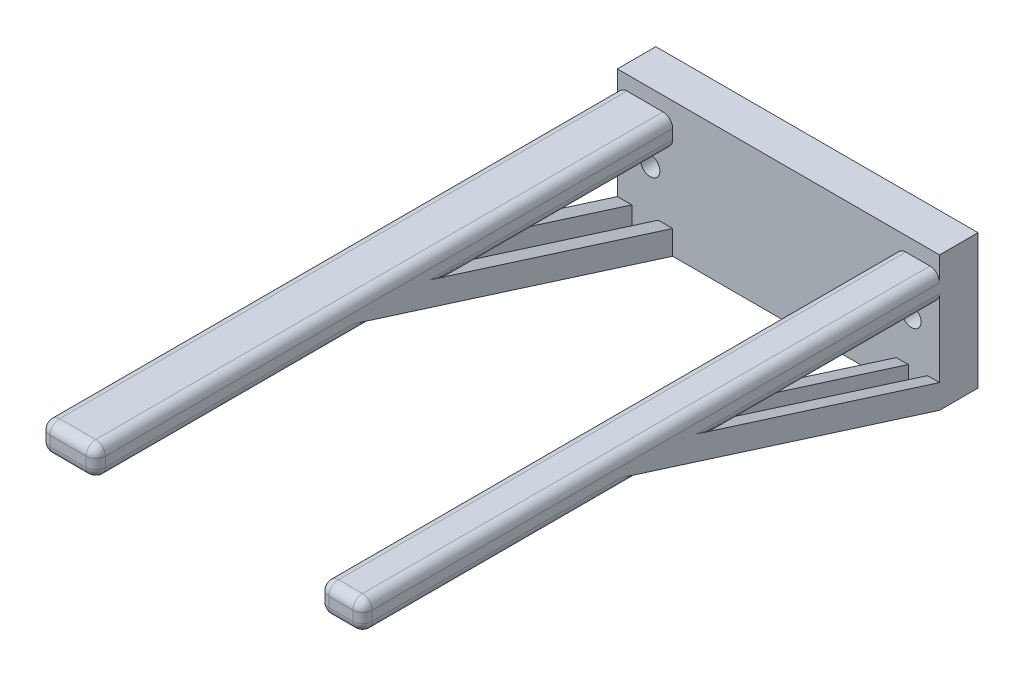
from build123d import *

# Parameters (mm, degrees)
ESQUISSE1_W             = 67
ESQUISSE1_H             = 28
BOSS_EXTRU_1_DEPTH      = 8
ESQUISSE2_W             = 11.5
ESQUISSE2_H             = 6
ESQUISSE2_W_2           = 9
BOSS_EXTRU_2_DEPTH      = 120
ESQUISSE4_R             = 2
ENL_V_MAT_EXTRU_2_DEPTH = 3
BOSS_EXTRU_3_DEPTH      = 11.5
ESQUISSE7_W             = 5.5
ESQUISSE7_H             = 19
ENL_V_MAT_EXTRU_3_DEPTH = 120
BOSS_EXTRU_4_DEPTH      = 9
ESQUISSE9_W             = 4
ESQUISSE9_H             = 19
ENL_V_MAT_EXTRU_4_DEPTH = 120
CONG_2_R                = 2


with BuildPart() as part:
    # Esquisse1 → Boss.-Extru.1 (new body)
    with BuildSketch(Plane.XY):
        with Locations((33.5, 14)):
            Rectangle(ESQUISSE1_W, ESQUISSE1_H)
    extrude(amount=BOSS_EXTRU_1_DEPTH)

    # Esquisse2 → Boss.-Extru.2 (add)
    with BuildSketch(Plane.XY.offset(8)):
        with Locations((5.75, 22)):
            Rectangle(ESQUISSE2_W, ESQUISSE2_H)
        with Locations((62.5, 22)):
            Rectangle(ESQUISSE2_W_2, ESQUISSE2_H)
    extrude(amount=BOSS_EXTRU_2_DEPTH)

    # Esquisse4 → Enlèv. mat.-Extru.2 (cut)
    with BuildSketch(Plane.XY.offset(8)):
        with Locations((6.83, 14)):
            Circle(ESQUISSE4_R)
        with Locations(Location((61.17, 14, 0), (0, 0, 180))):
            Circle(ESQUISSE4_R)
    extrude(amount=-ENL_V_MAT_EXTRU_2_DEPTH, mode=Mode.SUBTRACT)

    # Esquisse5 → Boss.-Extru.3 (add)
    with BuildSketch(Plane.ZY):
        Polygon((8, 0), (68, 19), (52.210526316, 19), (8, 5), align=None)
    extrude(amount=-BOSS_EXTRU_3_DEPTH)

    # Esquisse7 → Enlèv. mat.-Extru.3 (cut)
    with BuildSketch(Plane.XY.offset(128)):
        with Locations((5.75, 9.5)):
            Rectangle(ESQUISSE7_W, ESQUISSE7_H)
    extrude(amount=-ENL_V_MAT_EXTRU_3_DEPTH, mode=Mode.SUBTRACT)

    # Esquisse8 → Boss.-Extru.4 (add)
    with BuildSketch(Plane(origin=(67, 0, 0), x_dir=(0, 0, -1), z_dir=(1, 0, 0))):
        Polygon((-8, 0), (-8, 5), (-52.210526316, 19), (-68, 19), align=None)
    extrude(amount=-BOSS_EXTRU_4_DEPTH)

    # Esquisse9 → Enlèv. mat.-Extru.4 (cut)
    with BuildSketch(Plane.XY.offset(128)):
        with Locations((62.5, 9.5)):
            Rectangle(ESQUISSE9_W, ESQUISSE9_H)
    extrude(amount=-ENL_V_MAT_EXTRU_4_DEPTH, mode=Mode.SUBTRACT)

    # Congé2
    cong_2_edges = [part.edges().sort_by_distance(p)[0] for p in [
        (67, 19, 30.105263158),
        (58, 19, 30.105263158),
        (58, 25, 68),
        (58, 19, 98),
        (67, 19, 98),
        (67, 25, 68),
        (58, 22, 128),
        (62.5, 19, 128),
        (67, 22, 128),
        (62.5, 25, 128),
        (0, 19, 98),
        (11.5, 19, 98),
        (11.5, 25, 68),
        (0, 25, 68),
        (5.75, 19, 128),
        (11.5, 22, 128),
        (5.75, 25, 128),
        (0, 22, 128),
        (11.5, 19, 30.105263158),
        (0, 19, 30.105263158),
    ]]
    fillet(cong_2_edges, radius=CONG_2_R)


solid = part.part
